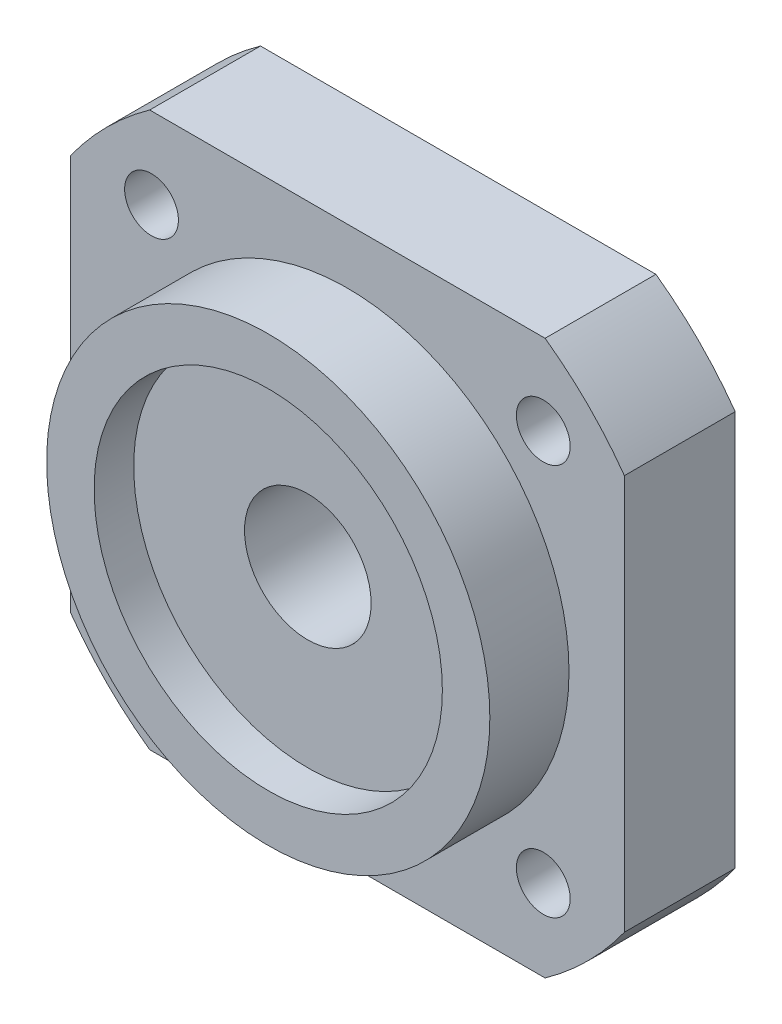
from build123d import *

# Parameters (mm, degrees)
BOSS_EXTRU_1_DEPTH                                 = 7
ESQUISSE2_W                                        = 14
ESQUISSE2_H                                        = 5
CHAMBRAGE_POUR_VIS_T_TE_HEXAGONALE_M31_D           = 3.4
CHAMBRAGE_POUR_VIS_T_TE_HEXAGONALE_M31_DEPTH       = 12
CHAMBRAGE_POUR_VIS_T_TE_HEXAGONALE_M31_CBORE_D     = 6
CHAMBRAGE_POUR_VIS_T_TE_HEXAGONALE_M31_CBORE_DEPTH = 3.3


with BuildPart() as part:
    # Esquisse1 → Boss.-Extru.1 (new body)
    with BuildSketch(Plane(origin=(0, 0, 0), x_dir=(-1, 0, 0), z_dir=(0, 0, -1))):
        with BuildLine():
            Line((-17.5, 12.489995997), (-17.5, -12.489995997))
            ThreePointArc((-17.5, -12.489995997), (-15.202795796, -15.202795796), (-12.489995997, -17.5))
            Line((-12.489995997, -17.5), (12.489995997, -17.5))
            ThreePointArc((12.489995997, -17.5), (15.202795796, -15.202795796), (17.5, -12.489995997))
            Line((17.5, -12.489995997), (17.5, 12.489995997))
            ThreePointArc((17.5, 12.489995997), (15.202795796, 15.202795796), (12.489995997, 17.5))
            Line((12.489995997, 17.5), (-12.489995997, 17.5))
            ThreePointArc((-12.489995997, 17.5), (-15.202795796, 15.202795796), (-17.5, 12.489995997))
        make_face()
    extrude(amount=-BOSS_EXTRU_1_DEPTH)

    # Esquisse2 → Révolution1 (revolve)
    with BuildSketch(Plane(origin=(0, 0, 0), x_dir=(1, 0, 0), z_dir=(0, 1, 0))):
        with Locations((7, -9.5)):
            Rectangle(ESQUISSE2_W, ESQUISSE2_H)
    revolve(axis=Axis((0, 0, 7), (0, 0, 1)))

    # Esquisse3 → Enlèvement de matière-Révolution1 (revolve, cut)
    with BuildSketch(Plane(origin=(0, 0, 0), x_dir=(1, 0, 0), z_dir=(0, 1, 0))):
        Polygon((11, 0), (0, 0), (0, -12), (11, -12), (11, -9.5), (4, -9.5), (4, -2.5), (11, -2.5), align=None)
    revolve(axis=Axis((0, 0, 0), (0, 0, 1)), mode=Mode.SUBTRACT)

    # Chambrage pour vis à tête hexagonale M31
    with Locations(Plane(origin=(0, 0, 0), x_dir=(-1, 0, 0), z_dir=(0, 0, -1))):
        with Locations((12.374368671, 12.374368671), (-12.374368671, 12.374368671), (-12.374368671, -12.374368671), (12.374368671, -12.374368671)):
            CounterBoreHole(CHAMBRAGE_POUR_VIS_T_TE_HEXAGONALE_M31_D / 2, CHAMBRAGE_POUR_VIS_T_TE_HEXAGONALE_M31_CBORE_D / 2, CHAMBRAGE_POUR_VIS_T_TE_HEXAGONALE_M31_CBORE_DEPTH, depth=CHAMBRAGE_POUR_VIS_T_TE_HEXAGONALE_M31_DEPTH)


solid = part.part
